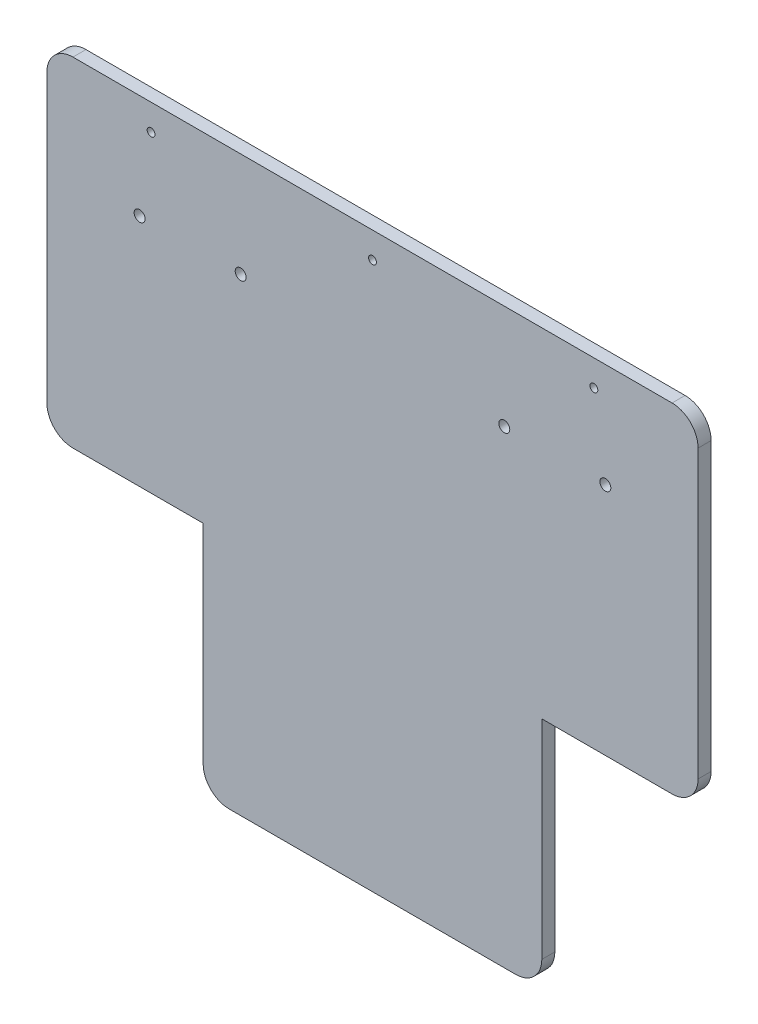
from build123d import *

# Parameters (mm, degrees)
EXTRUDE_1_DEPTH      = 5
SKETCH_9_R           = 1.5
CUT_EXTRUDE_7_DEPTH  = 5
SKETCH_7_R           = 2.1
CUT_EXTRUDE_8_DEPTH  = 5
CUT_EXTRUDE_9_REACH  = 335.054
SKETCH_10_W          = 60
SKETCH_10_H          = 90
CUT_EXTRUDE_11_REACH = 335.054


with BuildPart() as part:
    # 草图1 → 凸台-拉伸1 (new body)
    with BuildSketch(Plane.XY):
        with BuildLine():
            Line((10, 0), (240, 0))
            ThreePointArc((240, 0), (247.071067812, -2.928932188), (250, -10))
            Line((250, -10), (250, -210))
            ThreePointArc((250, -210), (247.071067812, -217.071067812), (240, -220))
            Line((240, -220), (10, -220))
            ThreePointArc((10, -220), (2.928932188, -217.071067812), (0, -210))
            Line((0, -210), (0, -10))
            ThreePointArc((0, -10), (2.928932188, -2.928932188), (10, 0))
        make_face()
    extrude(amount=EXTRUDE_1_DEPTH)

    # 草图9 → 切除-拉伸7 (cut)
    with BuildSketch(Plane.XY.offset(5)):
        with Locations((40, -10)):
            Circle(SKETCH_9_R)
        with Locations((125, -10)):
            Circle(SKETCH_9_R)
        with Locations((210, -10)):
            Circle(SKETCH_9_R)
    extrude(amount=-CUT_EXTRUDE_7_DEPTH, mode=Mode.SUBTRACT)

    # 草图7 → 切除-拉伸8 (cut)
    with BuildSketch(Plane(origin=(0, 0, 0), x_dir=(-1, 0, 0), z_dir=(0, 0, -1))):
        with Locations((-74.4, -40)):
            Circle(SKETCH_7_R)
        with Locations((-35.6, -40)):
            Circle(SKETCH_7_R)
        with Locations(Location((-214.4, -40, 0), (0, 0, 180))):
            Circle(SKETCH_7_R)
        with Locations(Location((-175.6, -40, 0), (0, 0, 180))):
            Circle(SKETCH_7_R)
    extrude(amount=-CUT_EXTRUDE_8_DEPTH, mode=Mode.SUBTRACT)

    # 草图10 → 切除-拉伸9 (cut, up to next)
    with BuildSketch(Plane.XY.offset(5), mode=Mode.PRIVATE) as cut_extrude_9_sk1:
        with Locations((220, -175)):
            Rectangle(SKETCH_10_W, SKETCH_10_H)
    cut_extrude_9_tool1 = extrude(cut_extrude_9_sk1.sketch, amount=-CUT_EXTRUDE_9_REACH, mode=Mode.PRIVATE) & part.part
    # 草图10 → 切除-拉伸9 (cut, up to next)
    with BuildSketch(Plane.XY.offset(5), mode=Mode.PRIVATE) as cut_extrude_9_sk2:
        with Locations((30, -175)):
            Rectangle(SKETCH_10_W, SKETCH_10_H)
    cut_extrude_9_tool2 = extrude(cut_extrude_9_sk2.sketch, amount=-CUT_EXTRUDE_9_REACH, mode=Mode.PRIVATE) & part.part
    add(cut_extrude_9_tool1.solids().sort_by_distance((220, -175, 5))[0], mode=Mode.SUBTRACT)
    add(cut_extrude_9_tool2.solids().sort_by_distance((30, -175, 5))[0], mode=Mode.SUBTRACT)

    # 草图11 → 切除-拉伸11 (cut, up to next)
    with BuildSketch(Plane.XY.offset(5), mode=Mode.PRIVATE) as cut_extrude_11_sk1:
        with BuildLine():
            Line((0, -130), (10, -130))
            ThreePointArc((10, -130), (2.928932188, -127.071067812), (0, -120))
            Line((0, -120), (0, -130))
        make_face()
    cut_extrude_11_tool1 = extrude(cut_extrude_11_sk1.sketch, amount=-CUT_EXTRUDE_11_REACH, mode=Mode.PRIVATE) & part.part
    # 草图11 → 切除-拉伸11 (cut, up to next)
    with BuildSketch(Plane.XY.offset(5), mode=Mode.PRIVATE) as cut_extrude_11_sk2:
        with BuildLine():
            ThreePointArc((70, -220), (62.928932188, -217.071067812), (60, -210))
            Line((60, -210), (60, -220))
            Line((60, -220), (70, -220))
        make_face()
    cut_extrude_11_tool2 = extrude(cut_extrude_11_sk2.sketch, amount=-CUT_EXTRUDE_11_REACH, mode=Mode.PRIVATE) & part.part
    # 草图11 → 切除-拉伸11 (cut, up to next)
    with BuildSketch(Plane.XY.offset(5), mode=Mode.PRIVATE) as cut_extrude_11_sk3:
        with BuildLine():
            ThreePointArc((190, -210), (187.071067812, -217.071067812), (180, -220))
            Line((180, -220), (190, -220))
            Line((190, -220), (190, -210))
        make_face()
    cut_extrude_11_tool3 = extrude(cut_extrude_11_sk3.sketch, amount=-CUT_EXTRUDE_11_REACH, mode=Mode.PRIVATE) & part.part
    # 草图11 → 切除-拉伸11 (cut, up to next)
    with BuildSketch(Plane.XY.offset(5), mode=Mode.PRIVATE) as cut_extrude_11_sk4:
        with BuildLine():
            ThreePointArc((250, -120), (247.071067812, -127.071067812), (240, -130))
            Line((240, -130), (250, -130))
            Line((250, -130), (250, -120))
        make_face()
    cut_extrude_11_tool4 = extrude(cut_extrude_11_sk4.sketch, amount=-CUT_EXTRUDE_11_REACH, mode=Mode.PRIVATE) & part.part
    add(cut_extrude_11_tool1.solids().sort_by_distance((2.233679, -127.766321, 5))[0], mode=Mode.SUBTRACT)
    add(cut_extrude_11_tool2.solids().sort_by_distance((62.233679, -217.766321, 5))[0], mode=Mode.SUBTRACT)
    add(cut_extrude_11_tool3.solids().sort_by_distance((187.766321, -217.766321, 5))[0], mode=Mode.SUBTRACT)
    add(cut_extrude_11_tool4.solids().sort_by_distance((247.766321, -127.766321, 5))[0], mode=Mode.SUBTRACT)


solid = part.part
